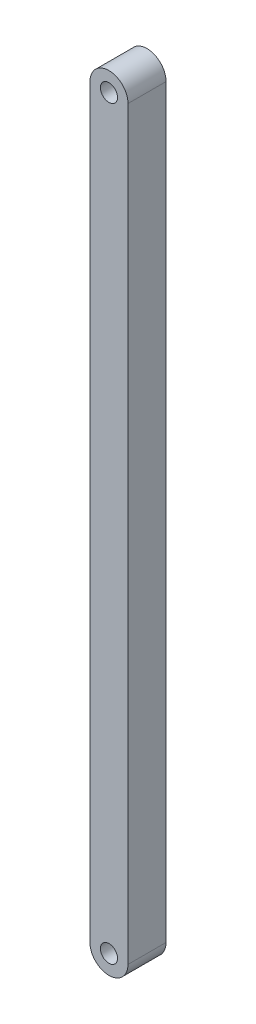
from build123d import *

# Parameters (mm, degrees)
ESBO_O1_R                = 2.25
RESSALTO_EXTRUS_O1_DEPTH = 10


with BuildPart() as part:
    # Esboço1 → Ressalto-extrusão1 (new body)
    with BuildSketch(Plane.XY):
        with BuildLine():
            Line((5, 195.85), (5, 0))
            ThreePointArc((5, 0), (0, -5), (-5, 0))
            Line((-5, 0), (-5, 195.85))
            ThreePointArc((-5, 195.85), (0, 200.85), (5, 195.85))
        make_face()
        Circle(ESBO_O1_R, mode=Mode.SUBTRACT)
        with Locations((0, 195.85)):
            Circle(ESBO_O1_R, mode=Mode.SUBTRACT)
    extrude(amount=RESSALTO_EXTRUS_O1_DEPTH)


solid = part.part
